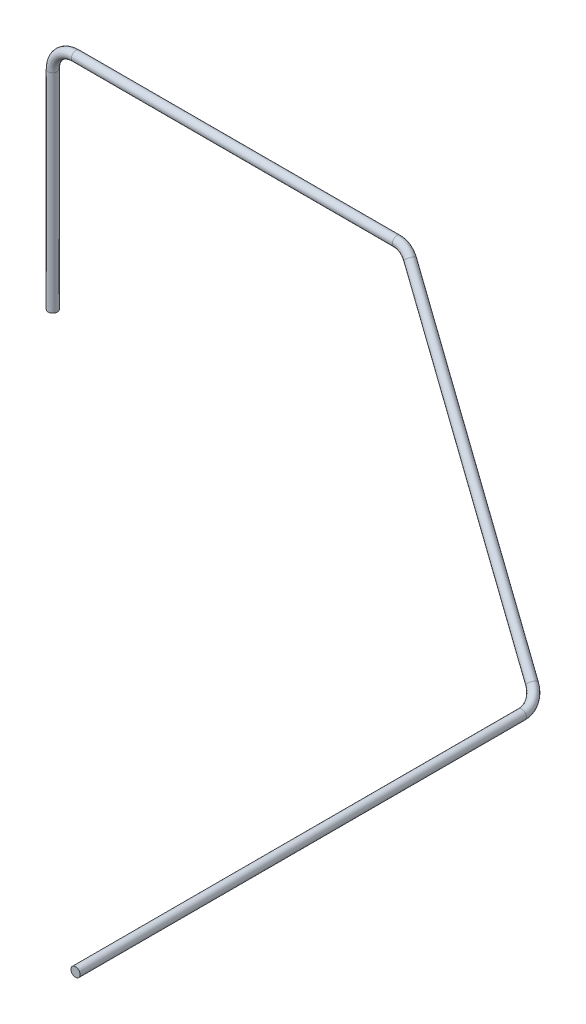
from build123d import *

# Parameters (mm, degrees)
SKETCH2_R = 2


with BuildPart() as part:
    # Sweep1: sweep along a curve in space
    with BuildLine() as sweep1_path:
        Line((0, 0, 0), (0, 90, 0))
        ThreePointArc((10, 100, 0), (2.928932188, 97.071067812, 0), (0, 90, 0))
        Line((10, 100, 0), (148.740796563, 100, 0))
        ThreePointArc((155.811864375, 97.404277412, 1.356785911), (152.567630886, 99.325393679, 0.35261717), (148.740796563, 100, 0))
        Line((155.811864375, 97.404277412, 1.356785911), (253.916422451, 10.460571975, 46.802318149))
        ThreePointArc((253.916422451, 10.460571975, 46.802318149), (257.562369033, 7.229406045, 50.452171424), (258.948949365, 6.00056985, 56.250632018))
        Line((258.948949365, 6.00056985, 56.250632018), (258.948949365, 6.00056985, 249.133564205))
    # Sketch2 → Sweep1 (sweep)
    with BuildSketch(Plane(origin=(0, 0, 0), x_dir=(1, 0, 0), z_dir=(0, 1, 0))):
        Circle(SKETCH2_R)
    sweep(path=sweep1_path.line)


solid = part.part
